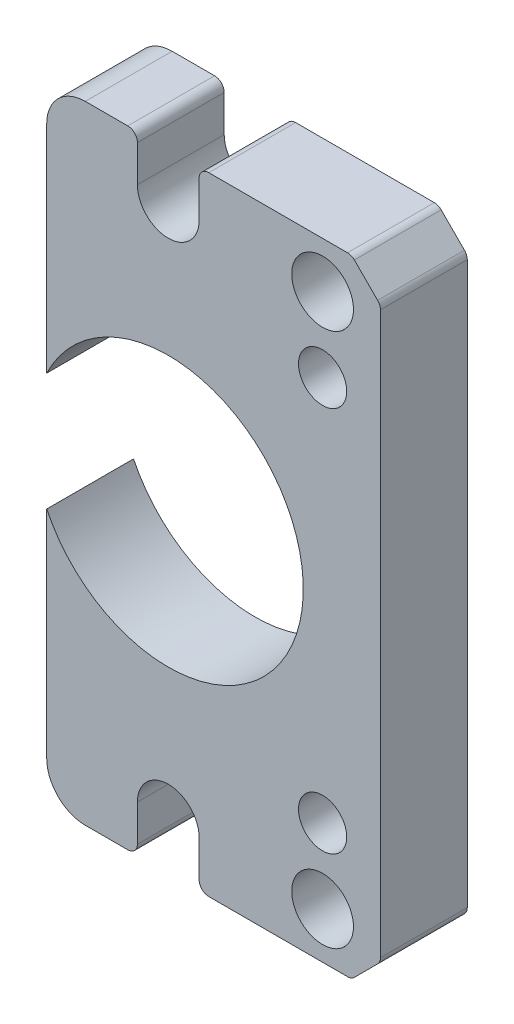
from build123d import *

# Parameters (mm, degrees)
ESBO_O1_R                = 1.25
ESBO_O1_R_2              = 1.6
ESBO_O1_R_3              = 7
RESSALTO_EXTRUS_O1_DEPTH = 4.5
ESBO_O2_W                = 9.082800448
ESBO_O2_H                = 32.5
CORTE_EXTRUS_O1_DEPTH    = 21.132374425
FILETE1_R                = 2


with BuildPart() as part:
    # Esboço1 → Ressalto-extrusão1 (new body)
    with BuildSketch(Plane(origin=(0, 0, -4.5), x_dir=(-1, 0, 0), z_dir=(0, 0, -1))):
        with BuildLine():
            Line((-10.853553391, -14.896446609), (-9.646446609, -16.103553391))
            ThreePointArc((-9.646446609, -16.103553391), (-9.484234935, -16.211939766), (-9.292893219, -16.25))
            Line((-9.292893219, -16.25), (-2.1, -16.25))
            ThreePointArc((-2.1, -16.25), (-1.746446609, -16.103553391), (-1.6, -15.75))
            Line((-1.6, -15.75), (-1.6, -13.856406461))
            ThreePointArc((-1.6, -13.856406461), (0, -12.256406461), (1.6, -13.856406461))
            Line((1.6, -13.856406461), (1.6, -15.75))
            ThreePointArc((1.6, -15.75), (1.746446609, -16.103553391), (2.1, -16.25))
            Line((2.1, -16.25), (9.292893219, -16.25))
            ThreePointArc((9.292893219, -16.25), (9.484234935, -16.211939766), (9.646446609, -16.103553391))
            Line((9.646446609, -16.103553391), (10.853553391, -14.896446609))
            ThreePointArc((10.853553391, -14.896446609), (10.961939766, -14.734234935), (11, -14.542893219))
            Line((11, -14.542893219), (11, 14.542893219))
            ThreePointArc((11, 14.542893219), (10.961939766, 14.734234935), (10.853553391, 14.896446609))
            Line((10.853553391, 14.896446609), (9.646446609, 16.103553391))
            ThreePointArc((9.646446609, 16.103553391), (9.484234935, 16.211939766), (9.292893219, 16.25))
            Line((9.292893219, 16.25), (2.1, 16.25))
            ThreePointArc((2.1, 16.25), (1.746446609, 16.103553391), (1.6, 15.75))
            Line((1.6, 15.75), (1.6, 13.856406461))
            ThreePointArc((1.6, 13.856406461), (0, 12.256406461), (-1.6, 13.856406461))
            Line((-1.6, 13.856406461), (-1.6, 15.75))
            ThreePointArc((-1.6, 15.75), (-1.746446609, 16.103553391), (-2.1, 16.25))
            Line((-2.1, 16.25), (-9.292893219, 16.25))
            ThreePointArc((-9.292893219, 16.25), (-9.484234935, 16.211939766), (-9.646446609, 16.103553391))
            Line((-9.646446609, 16.103553391), (-10.853553391, 14.896446609))
            ThreePointArc((-10.853553391, 14.896446609), (-10.961939766, 14.734234935), (-11, 14.542893219))
            Line((-11, 14.542893219), (-11, -14.542893219))
            ThreePointArc((-11, -14.542893219), (-10.961939766, -14.734234935), (-10.853553391, -14.896446609))
        make_face()
        with Locations(Location((-8, -10, 0), (0, 0, 180))):
            Circle(ESBO_O1_R, mode=Mode.SUBTRACT)
        with Locations(Location((8, -10, 0), (0, 0, 180))):
            Circle(ESBO_O1_R, mode=Mode.SUBTRACT)
        with Locations(Location((8, 10, 0), (0, 0, 180))):
            Circle(ESBO_O1_R, mode=Mode.SUBTRACT)
        with Locations(Location((-8, 10, 0), (0, 0, 180))):
            Circle(ESBO_O1_R, mode=Mode.SUBTRACT)
        with Locations(Location((-8, -13.85640646, 0), (0, 0, 180))):
            Circle(ESBO_O1_R_2, mode=Mode.SUBTRACT)
        with Locations(Location((8, -13.85640646, 0), (0, 0, 180))):
            Circle(ESBO_O1_R_2, mode=Mode.SUBTRACT)
        with Locations(Location((8, 13.85640646, 0), (0, 0, 180))):
            Circle(ESBO_O1_R_2, mode=Mode.SUBTRACT)
        with Locations(Location((-8, 13.85640646, 0), (0, 0, 180))):
            Circle(ESBO_O1_R_2, mode=Mode.SUBTRACT)
        with Locations(Location((0, 0, 0), (0, 0, 180))):
            Circle(ESBO_O1_R_3, mode=Mode.SUBTRACT)
    extrude(amount=-RESSALTO_EXTRUS_O1_DEPTH)

    # Esboço2 → Corte-extrusão1 (cut, through all)
    with BuildSketch(Plane.XY):
        with Locations((-10.842301115, 0)):
            Rectangle(ESBO_O2_W, ESBO_O2_H)
    extrude(amount=-CORTE_EXTRUS_O1_DEPTH, mode=Mode.SUBTRACT)

    # Filete1
    filete1_edges = [part.edges().sort_by_distance(p)[0] for p in [
        (-6.300900891, 16.25, -2.25),
        (-6.300900891, -16.25, -2.25),
    ]]
    fillet(filete1_edges, radius=FILETE1_R)


solid = part.part
